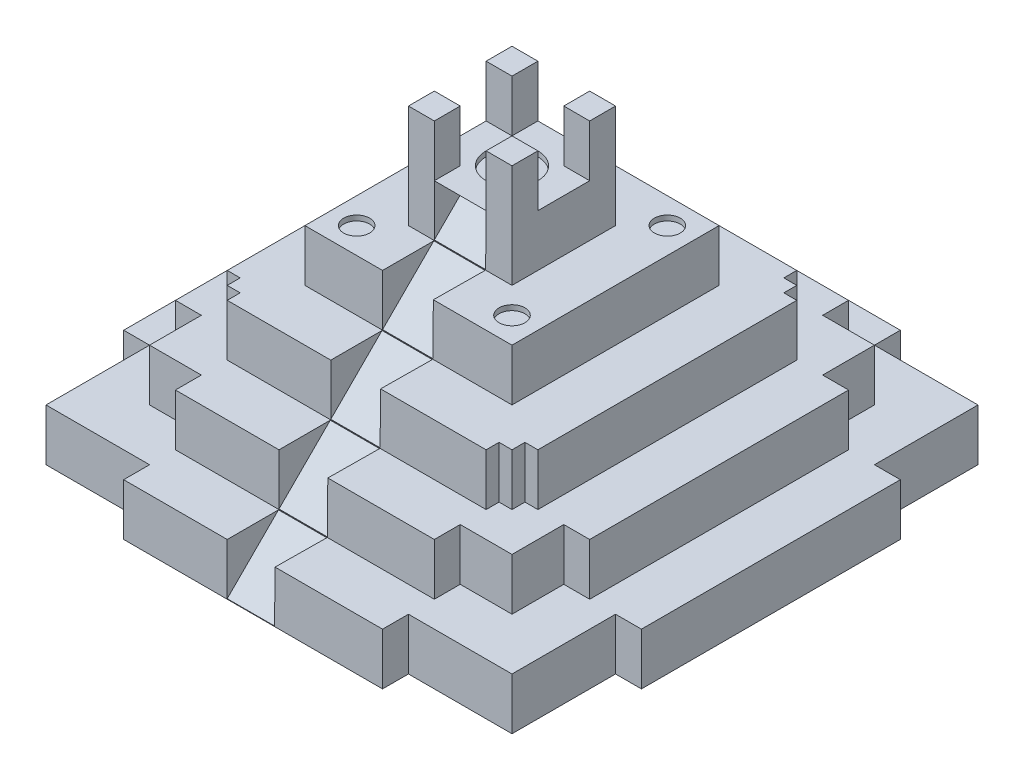
from build123d import *

# Parameters (mm, degrees)
SKETCH2_W               = 1000
SKETCH2_H               = 1000
BOSS_EXTRUDE1_DEPTH     = 100
SKETCH3_W               = 800
SKETCH3_H               = 800
BOSS_EXTRUDE2_DEPTH     = 100
SKETCH4_W               = 600
SKETCH4_H               = 600
BOSS_EXTRUDE3_DEPTH     = 100
SKETCH5_W               = 400
SKETCH5_H               = 400
BOSS_EXTRUDE4_DEPTH     = 100
SKETCH6_W               = 200
SKETCH6_H               = 200
BOSS_EXTRUDE5_DEPTH     = 100
CUT_EXTRUDE2_DEPTH      = 1470.69384567
CUT_EXTRUDE2_DEPTH_BACK = 1470.69384567
SKETCH8_W               = 250
SKETCH8_H               = 250
CUT_EXTRUDE3_DEPTH      = 1519.222645069
CUT_EXTRUDE3_DEPTH_BACK = 70
SKETCH17_W              = 200
SKETCH17_H              = 200
BOSS_EXTRUDE6_DEPTH     = 100
SKETCH18_W              = 100
SKETCH18_H              = 100
BOSS_EXTRUDE7_DEPTH     = 100
SKETCH19_W              = 25
SKETCH19_H              = 25
BOSS_EXTRUDE8_DEPTH     = 100
SKETCH20_W              = 50
SKETCH20_H              = 50
BOSS_EXTRUDE9_DEPTH     = 100
SKETCH21_R              = 50
CUT_EXTRUDE4_DEPTH      = 10
SKETCH22_R              = 25
CUT_EXTRUDE5_DEPTH      = 10


with BuildPart() as part:
    # Sketch2 → Boss-Extrude1 (new body)
    with BuildSketch(Plane(origin=(0, 0, 0), x_dir=(1, 0, 0), z_dir=(0, 1, 0))):
        with Locations((500, 500)):
            Rectangle(SKETCH2_W, SKETCH2_H)
    extrude(amount=BOSS_EXTRUDE1_DEPTH)

    # Sketch3 → Boss-Extrude2 (add)
    with BuildSketch(Plane(origin=(0, 100, 0), x_dir=(1, 0, 0), z_dir=(0, 1, 0))):
        with Locations((500, 500)):
            Rectangle(SKETCH3_W, SKETCH3_H)
    extrude(amount=BOSS_EXTRUDE2_DEPTH)

    # Sketch4 → Boss-Extrude3 (add)
    with BuildSketch(Plane(origin=(0, 200, 0), x_dir=(1, 0, 0), z_dir=(0, 1, 0))):
        with Locations((500, 500)):
            Rectangle(SKETCH4_W, SKETCH4_H)
    extrude(amount=BOSS_EXTRUDE3_DEPTH)

    # Sketch5 → Boss-Extrude4 (add)
    with BuildSketch(Plane(origin=(0, 300, 0), x_dir=(1, 0, 0), z_dir=(0, 1, 0))):
        with Locations((500, 500)):
            Rectangle(SKETCH5_W, SKETCH5_H)
    extrude(amount=BOSS_EXTRUDE4_DEPTH)

    # Sketch6 → Boss-Extrude5 (add)
    with BuildSketch(Plane(origin=(0, 400, 0), x_dir=(1, 0, 0), z_dir=(0, 1, 0))):
        with Locations((500, 500)):
            Rectangle(SKETCH6_W, SKETCH6_H)
    extrude(amount=BOSS_EXTRUDE5_DEPTH)

    # Sketch8 → Cut-Extrude2 (cut, two sides: drawn at the far end of the back side and taken through both)
    with BuildSketch(Plane(origin=(0, 100, 0), x_dir=(1, 0, 0), z_dir=(0, 1, 0)).offset(-CUT_EXTRUDE2_DEPTH_BACK)):
        with Locations((125, 125)):
            Rectangle(SKETCH8_W, SKETCH8_H)
        with Locations((875, 125)):
            Rectangle(SKETCH8_W, SKETCH8_H)
        with Locations((875, 875)):
            Rectangle(SKETCH8_W, SKETCH8_H)
        with Locations((125, 875)):
            Rectangle(SKETCH8_W, SKETCH8_H)
    extrude(amount=CUT_EXTRUDE2_DEPTH + CUT_EXTRUDE2_DEPTH_BACK, mode=Mode.SUBTRACT)

    # Sketch16 → Cut-Extrude3 (cut, two sides: drawn at the far end of the back side and taken through both)
    with BuildSketch(Plane(origin=(0, 50, 50), x_dir=(1, 0, 0), z_dir=(0, 0.7071067811865477, 0.7071067811865475)).offset(-CUT_EXTRUDE3_DEPTH_BACK)):
        Polygon((450, 636.396103068), (450, -32.366607249), (540.963803132, -32.366607249), (550, 636.396103068), align=None)
    extrude(amount=CUT_EXTRUDE3_DEPTH + CUT_EXTRUDE3_DEPTH_BACK, mode=Mode.SUBTRACT)

    # Sketch17 → Boss-Extrude6 (add)
    with BuildSketch(Plane(origin=(0, 0, 0), x_dir=(1, 0, 0), z_dir=(0, 1, 0))):
        with Locations((150, 850)):
            Rectangle(SKETCH17_W, SKETCH17_H)
        with Locations((850, 850)):
            Rectangle(SKETCH17_W, SKETCH17_H)
        with Locations((850, 150)):
            Rectangle(SKETCH17_W, SKETCH17_H)
        with Locations((150, 150)):
            Rectangle(SKETCH17_W, SKETCH17_H)
    extrude(amount=BOSS_EXTRUDE6_DEPTH)

    # Sketch18 → Boss-Extrude7 (add)
    with BuildSketch(Plane(origin=(0, 100, 0), x_dir=(1, 0, 0), z_dir=(0, 1, 0))):
        with Locations((200, 200)):
            Rectangle(SKETCH18_W, SKETCH18_H)
        with Locations((800, 200)):
            Rectangle(SKETCH18_W, SKETCH18_H)
        with Locations((800, 800)):
            Rectangle(SKETCH18_W, SKETCH18_H)
        with Locations((200, 800)):
            Rectangle(SKETCH18_W, SKETCH18_H)
    extrude(amount=BOSS_EXTRUDE7_DEPTH)

    # Sketch19 → Boss-Extrude8 (add)
    with BuildSketch(Plane(origin=(0, 200, 0), x_dir=(1, 0, 0), z_dir=(0, 1, 0))):
        with Locations((762.5, 237.5)):
            Rectangle(SKETCH19_W, SKETCH19_H)
        with Locations((762.5, 762.5)):
            Rectangle(SKETCH19_W, SKETCH19_H)
        with Locations((237.5, 762.5)):
            Rectangle(SKETCH19_W, SKETCH19_H)
        with Locations((237.5, 237.5)):
            Rectangle(SKETCH19_W, SKETCH19_H)
    extrude(amount=BOSS_EXTRUDE8_DEPTH)

    # Sketch20 → Boss-Extrude9 (add)
    with BuildSketch(Plane(origin=(0, 500, 0), x_dir=(1, 0, 0), z_dir=(0, 1, 0))):
        with Locations((425, 575)):
            Rectangle(SKETCH20_W, SKETCH20_H)
        with Locations((425, 425)):
            Rectangle(SKETCH20_W, SKETCH20_H)
        with Locations((575, 425)):
            Rectangle(SKETCH20_W, SKETCH20_H)
        with Locations((575, 575)):
            Rectangle(SKETCH20_W, SKETCH20_H)
    extrude(amount=BOSS_EXTRUDE9_DEPTH)

    # Sketch21 → Cut-Extrude4 (cut)
    with BuildSketch(Plane(origin=(0, 500, 0), x_dir=(1, 0, 0), z_dir=(0, 1, 0))):
        with Locations(Location((500, 500, 0), (0, 0, 270))):
            Circle(SKETCH21_R)
    extrude(amount=-CUT_EXTRUDE4_DEPTH, mode=Mode.SUBTRACT)

    # Sketch22 → Cut-Extrude5 (cut)
    with BuildSketch(Plane(origin=(0, 400, 0), x_dir=(1, 0, 0), z_dir=(0, 1, 0))):
        with Locations(Location((350, 650, 0), (0, 0, 270))):
            Circle(SKETCH22_R)
        with Locations(Location((650, 650, 0), (0, 0, 90))):
            Circle(SKETCH22_R)
        with Locations(Location((650, 350, 0), (0, 0, 270))):
            Circle(SKETCH22_R)
        with Locations(Location((350, 350, 0), (0, 0, 90))):
            Circle(SKETCH22_R)
    extrude(amount=-CUT_EXTRUDE5_DEPTH, mode=Mode.SUBTRACT)


solid = part.part
